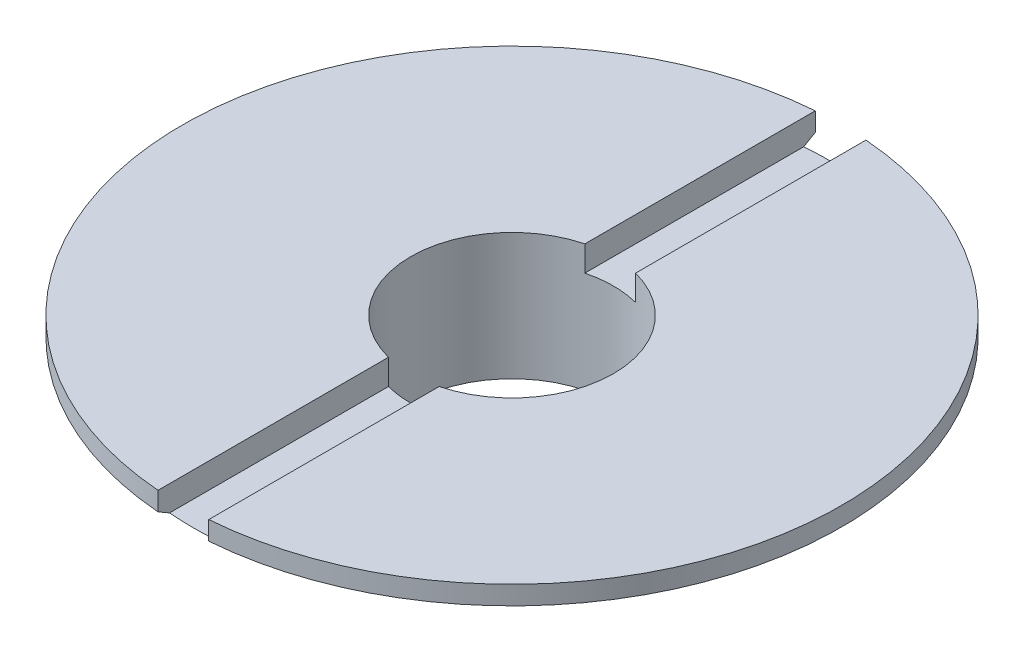
from build123d import *

# Parameters (mm, degrees)
CUT_EXTRUDE_THIN2_DEPTH      = 20.052558883
CUT_EXTRUDE_THIN2_DEPTH_BACK = 1
SKETCH2_W                    = 2
SKETCH2_H                    = 26


with BuildPart() as part:
    # Sketch1 → Revolve1 (revolve)
    with BuildSketch(Plane(origin=(0, 0, 0), x_dir=(0, 0, -1), z_dir=(1, 0, 0))):
        Polygon((-13, 1.761213565), (-5.619361604, -2.5), (-4, -2.5), (-4, 2.5), (-13, 2.5), align=None)
    revolve(axis=Axis((0, 36.09806212, 0), (0, -1, 0)))

    # Sketch2 → Cut-Extrude-Thin2 (cut, two sides: drawn at the far end of the back side and taken through both)
    with BuildSketch(Plane(origin=(0, 2.5, 0), x_dir=(1, 0, 0), z_dir=(0, 1, 0)).offset(-CUT_EXTRUDE_THIN2_DEPTH_BACK)):
        Rectangle(SKETCH2_W, SKETCH2_H)
    extrude(amount=CUT_EXTRUDE_THIN2_DEPTH + CUT_EXTRUDE_THIN2_DEPTH_BACK, mode=Mode.SUBTRACT)


solid = part.part
